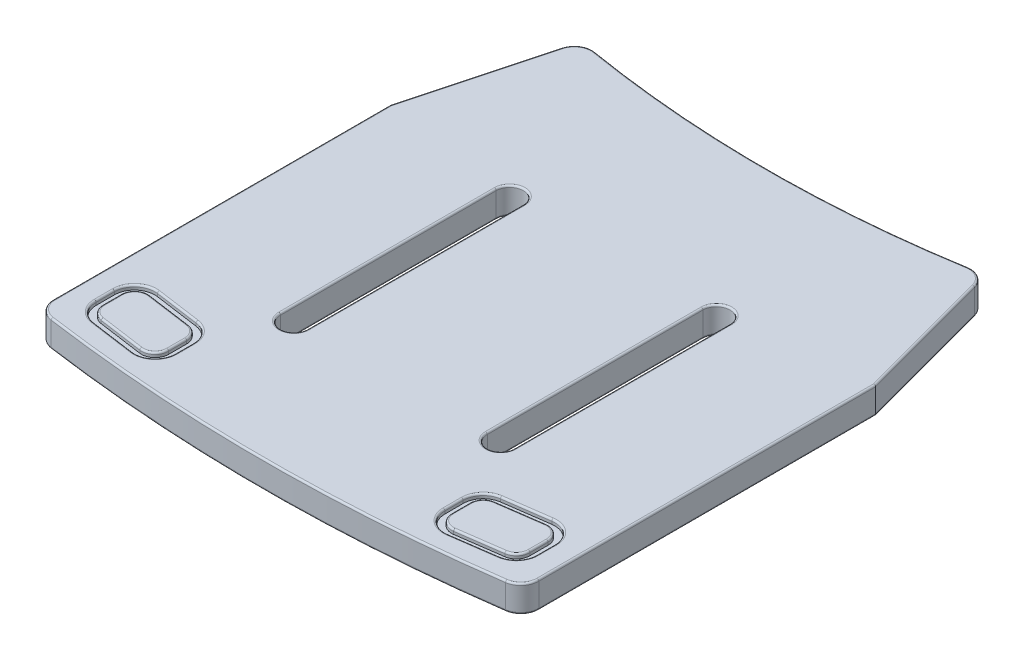
from build123d import *

# Parameters (mm, degrees)
BOSS_EXTRUDE1_DEPTH = 3
FILLET1_R           = 0.2
CUT_EXTRUDE1_DEPTH  = 0.5
FILLET2_R           = 0.2


with BuildPart() as part:
    # Sketch1 → Boss-Extrude1 (new body)
    with BuildSketch(Plane(origin=(0, 0, 0), x_dir=(1, 0, 0), z_dir=(0, 1, 0))):
        with BuildLine():
            Line((-27, 3.734833278), (-27, 41.21477169))
            Line((-27, 41.21477169), (-22.972622015, 56.245150951))
            ThreePointArc((-22.972622015, 56.245150951), (-22.124373546, 57.408525693), (-20.714556868, 57.700729716))
            ThreePointArc((-20.714556868, 57.700729716), (0, 56), (20.714556868, 57.700729716))
            ThreePointArc((20.714556868, 57.700729716), (22.124373546, 57.408525693), (22.972622015, 56.245150951))
            Line((22.972622015, 56.245150951), (27, 41.21477169))
            Line((27, 41.21477169), (27, 3.734833278))
            ThreePointArc((27, 3.734833278), (26.508722338, 2.421914047), (25.276243094, 1.754002706))
            ThreePointArc((25.276243094, 1.754002706), (0, 0), (-25.276243094, 1.754002706))
            ThreePointArc((-25.276243094, 1.754002706), (-26.508722338, 2.421914047), (-27, 3.734833278))
        make_face()
        with BuildLine():
            Line((-10, 39), (-10, 15))
            ThreePointArc((-10, 15), (-11.5, 13.5), (-13, 15))
            Line((-13, 15), (-13, 39))
            ThreePointArc((-13, 39), (-11.5, 40.5), (-10, 39))
        make_face(mode=Mode.SUBTRACT)
        with BuildLine():
            Line((10, 39), (10, 15))
            ThreePointArc((10, 15), (11.5, 13.5), (13, 15))
            Line((13, 15), (13, 39))
            ThreePointArc((13, 39), (11.5, 40.5), (10, 39))
        make_face(mode=Mode.SUBTRACT)
    extrude(amount=BOSS_EXTRUDE1_DEPTH)

    # Fillet1
    fillet1_edges = [part.edges().sort_by_distance(p)[0] for p in [
        (26.508722338, 3, -2.421914047),
        (-22.124373546, 0, -57.408525693),
        (0, 0, -56),
        (22.124373546, 0, -57.408525693),
        (24.986311008, 0, -48.729961321),
        (27, 0, -22.474802484),
        (26.508722338, 0, -2.421914047),
        (0, 0, 0),
        (-26.508722338, 0, -2.421914047),
        (27, 3, -22.474802484),
        (24.986311008, 3, -48.729961321),
        (22.124373546, 3, -57.408525693),
        (0, 3, -56),
        (-22.124373546, 3, -57.408525693),
        (-24.986311008, 3, -48.729961321),
        (-11.5, 0, -40.5),
        (-13, 0, -27),
        (-11.5, 0, -13.5),
        (-10, 0, -27),
        (-11.5, 3, -40.5),
        (-13, 3, -27),
        (-11.5, 3, -13.5),
        (-10, 3, -27),
        (-27, 3, -22.474802484),
        (-26.508722338, 3, -2.421914047),
        (11.5, 0, -40.5),
        (10, 0, -27),
        (11.5, 0, -13.5),
        (13, 0, -27),
        (11.5, 3, -40.5),
        (10, 3, -27),
        (11.5, 3, -13.5),
        (13, 3, -27),
        (0, 3, 0),
        (-27, 0, -22.474802484),
        (-24.986311008, 0, -48.729961321),
    ]]
    fillet(fillet1_edges, radius=FILLET1_R)

    # Sketch2 → Cut-Extrude1 (cut)
    # profile 1 of 2: a face of its own
    with BuildSketch(Plane(origin=(0, 3, 0), x_dir=(1, 0, 0), z_dir=(0, 1, 0))):
        with BuildLine():
            Line((-16.936860523, 9.541298132), (-21.936860523, 10.244002305))
            ThreePointArc((-21.936860523, 10.244002305), (-23.726132815, 9.713995706), (-24.5, 8.015899151))
            Line((-24.5, 8.015899151), (-24.5, 5.996244006))
            ThreePointArc((-24.5, 5.996244006), (-23.948096556, 4.520111191), (-22.563139477, 3.768140851))
            Line((-22.563139477, 3.768140851), (-17.563139477, 3.065436678))
            ThreePointArc((-17.563139477, 3.065436678), (-15.773867185, 3.595443277), (-15, 5.293539832))
            Line((-15, 5.293539832), (-15, 7.313194977))
            ThreePointArc((-15, 7.313194977), (-15.551903444, 8.789327793), (-16.936860523, 9.541298132))
        make_face()
        with BuildLine():
            Line((-23.75, 8.015899151), (-23.75, 5.996244006))
            ThreePointArc((-23.75, 5.996244006), (-23.38206437, 5.012155462), (-22.458759651, 4.510841903))
            Line((-22.458759651, 4.510841903), (-17.458759651, 3.808137729))
            ThreePointArc((-17.458759651, 3.808137729), (-16.265911457, 4.161475462), (-15.75, 5.293539832))
            Line((-15.75, 5.293539832), (-15.75, 7.313194977))
            ThreePointArc((-15.75, 7.313194977), (-16.11793563, 8.297283521), (-17.041240349, 8.79859708))
            Line((-17.041240349, 8.79859708), (-22.041240349, 9.501301254))
            ThreePointArc((-22.041240349, 9.501301254), (-23.234088543, 9.147963521), (-23.75, 8.015899151))
        make_face(mode=Mode.SUBTRACT)
    # profile 2 of 2: a face of its own
    with BuildSketch(Plane(origin=(0, 3, 0), x_dir=(1, 0, 0), z_dir=(0, 1, 0))):
        with BuildLine():
            Line((15, 5.293539832), (15, 7.313194977))
            ThreePointArc((15, 7.313194977), (15.551903444, 8.789327793), (16.936860523, 9.541298132))
            Line((16.936860523, 9.541298132), (21.936860523, 10.244002305))
            ThreePointArc((21.936860523, 10.244002305), (23.726132815, 9.713995706), (24.5, 8.015899151))
            Line((24.5, 8.015899151), (24.5, 5.996244006))
            ThreePointArc((24.5, 5.996244006), (23.948096556, 4.520111191), (22.563139477, 3.768140851))
            Line((22.563139477, 3.768140851), (17.563139477, 3.065436678))
            ThreePointArc((17.563139477, 3.065436678), (15.773867185, 3.595443277), (15, 5.293539832))
        make_face()
        with BuildLine():
            Line((17.041240349, 8.79859708), (22.041240349, 9.501301254))
            ThreePointArc((22.041240349, 9.501301254), (23.234088543, 9.147963521), (23.75, 8.015899151))
            Line((23.75, 8.015899151), (23.75, 5.996244006))
            ThreePointArc((23.75, 5.996244006), (23.38206437, 5.012155462), (22.458759651, 4.510841903))
            Line((22.458759651, 4.510841903), (17.458759651, 3.808137729))
            ThreePointArc((17.458759651, 3.808137729), (16.265911457, 4.161475462), (15.75, 5.293539832))
            Line((15.75, 5.293539832), (15.75, 7.313194977))
            ThreePointArc((15.75, 7.313194977), (16.11793563, 8.297283521), (17.041240349, 8.79859708))
        make_face(mode=Mode.SUBTRACT)
    extrude(amount=-CUT_EXTRUDE1_DEPTH, mode=Mode.SUBTRACT)

    # Fillet2
    fillet2_edges = [part.edges().sort_by_distance(p)[0] for p in [
        (-15.551903444, 3, -8.789327793),
        (-19.436860523, 3, -9.892650219),
        (-23.726132815, 3, -9.713995706),
        (-24.5, 3, -7.006071578),
        (-23.948096556, 3, -4.520111191),
        (-20.063139477, 3, -3.416788764),
        (-15.773867185, 3, -3.595443277),
        (-15, 3, -6.303367405),
        (-16.11793563, 3, -8.297283521),
        (-15.75, 3, -6.303367405),
        (-16.265911457, 3, -4.161475462),
        (-19.958759651, 3, -4.159489816),
        (-23.38206437, 3, -5.012155462),
        (-23.75, 3, -7.006071578),
        (-23.234088543, 3, -9.147963521),
        (-19.541240349, 3, -9.149949167),
        (23.948096556, 3, -4.520111191),
        (24.5, 3, -7.006071578),
        (23.726132815, 3, -9.713995706),
        (19.436860523, 3, -9.892650219),
        (15.551903444, 3, -8.789327793),
        (15, 3, -6.303367405),
        (15.773867185, 3, -3.595443277),
        (20.063139477, 3, -3.416788764),
        (16.11793563, 3, -8.297283521),
        (19.541240349, 3, -9.149949167),
        (23.234088543, 3, -9.147963521),
        (23.75, 3, -7.006071578),
        (23.38206437, 3, -5.012155462),
        (19.958759651, 3, -4.159489816),
        (16.265911457, 3, -4.161475462),
        (15.75, 3, -6.303367405),
    ]]
    fillet(fillet2_edges, radius=FILLET2_R)


solid = part.part
